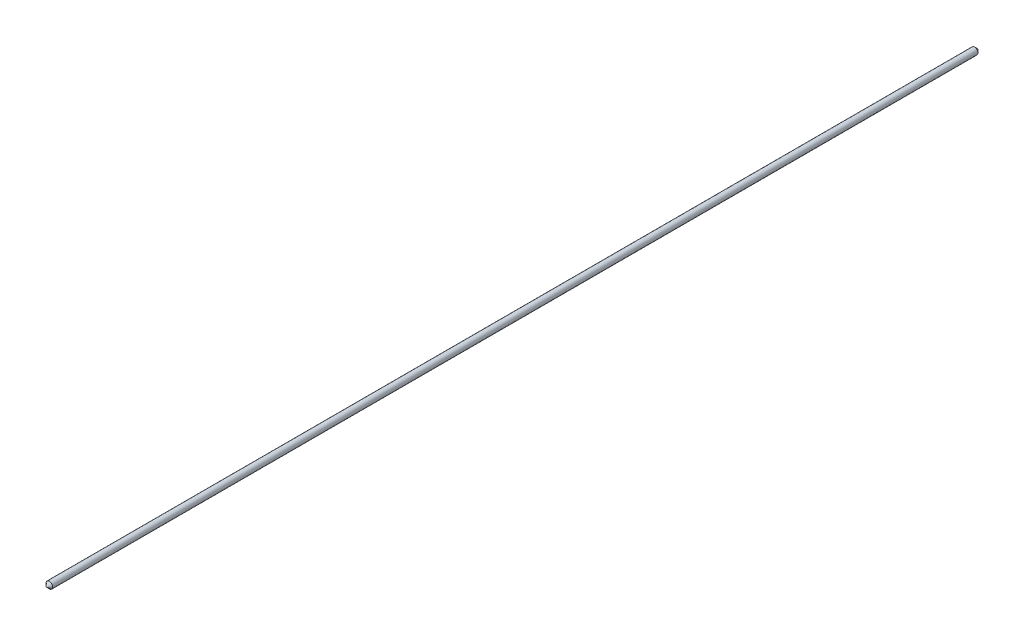
from build123d import *


with BuildPart() as part:
    # Sketch1 → Revolve1 (revolve)
    with BuildSketch(Plane(origin=(0, 0, 0), x_dir=(0, 0, -1), z_dir=(1, 0, 0)), mode=Mode.PRIVATE) as revolve1_sk:
        Polygon((-32.367713513, 0), (-22.666881126, 10), (2743.640292116, 10), (2753.952286487, 0), (2057.660148801, 0), align=None)
    revolve(revolve1_sk.sketch.rotate(Axis((0, 0, 32.367713513), (0, 0, -1)), 180), axis=Axis((0, 0, 32.367713513), (0, 0, -1)))


solid = part.part
